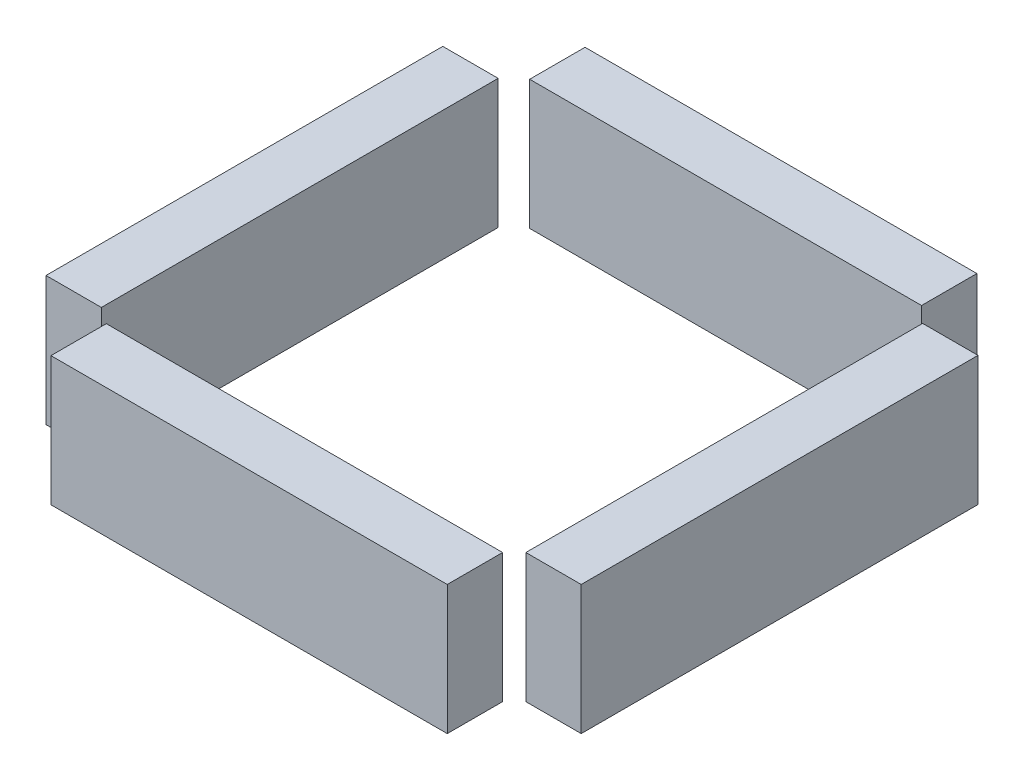
from build123d import *

# Parameters (mm, degrees)
SKETCH7_W             = 6
SKETCH7_H             = 43
BOSS_EXTRUDE3_DEPTH   = 14
BOSS_EXTRUDE3_2_DEPTH = 14
SKETCH7_W_2           = 42.947816596
SKETCH7_H_2           = 6
BOSS_EXTRUDE3_3_DEPTH = 14
SKETCH7_W_3           = 42.465256858
BOSS_EXTRUDE3_4_DEPTH = 14


with BuildPart() as part:
    # Sketch7 → Boss-Extrude3 (new body)
    with BuildSketch(Plane(origin=(0, 0, -1.5875), x_dir=(-1, 0, 0), z_dir=(0, 1, 0))):
        with Locations((-40.797984883, -45.302636894)):
            Rectangle(SKETCH7_W, SKETCH7_H)
    extrude(amount=BOSS_EXTRUDE3_DEPTH)


with BuildPart() as body_2:
    # Sketch7 → Boss-Extrude3 2 (new body)
    with BuildSketch(Plane(origin=(0, 0, -1.5875), x_dir=(-1, 0, 0), z_dir=(0, 1, 0))):
        with Locations((-92.797984883, -45.302636894)):
            Rectangle(SKETCH7_W, SKETCH7_H)
    extrude(amount=BOSS_EXTRUDE3_2_DEPTH)


with BuildPart() as body_3:
    # Sketch7 → Boss-Extrude3 3 (new body)
    with BuildSketch(Plane(origin=(0, 0, -1.5875), x_dir=(-1, 0, 0), z_dir=(0, 1, 0))):
        with Locations((-67.065246949, -19.544955527)):
            Rectangle(SKETCH7_W_2, SKETCH7_H_2)
    extrude(amount=BOSS_EXTRUDE3_3_DEPTH)


with BuildPart() as body_4:
    # Sketch7 → Boss-Extrude3 4 (new body)
    with BuildSketch(Plane(origin=(0, 0, -1.5875), x_dir=(-1, 0, 0), z_dir=(0, 1, 0))):
        with Locations((-66.82396708, -71.424390412)):
            Rectangle(SKETCH7_W_3, SKETCH7_H_2)
    extrude(amount=BOSS_EXTRUDE3_4_DEPTH)


solid = Compound([part.part, body_2.part, body_3.part, body_4.part])
